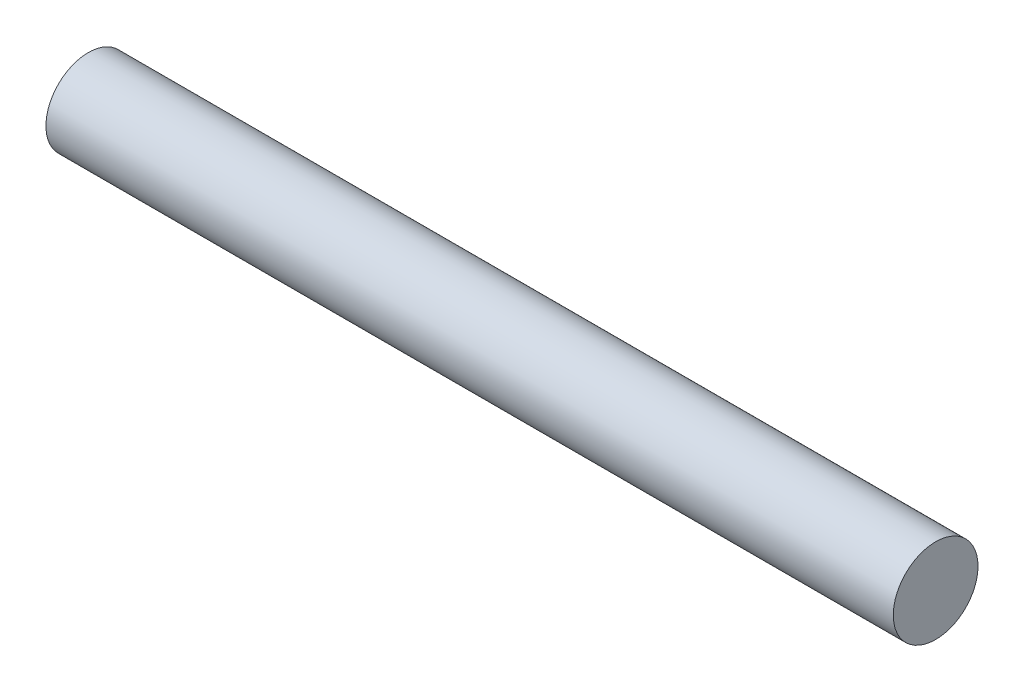
from build123d import *

# Parameters (mm, degrees)
SKETCH2_R           = 5
BOSS_EXTRUDE1_DEPTH = 100


with BuildPart() as part:
    # Sketch2 → Boss-Extrude1 (new body)
    with BuildSketch(Plane(origin=(0, 0, 0), x_dir=(0, 0, -1), z_dir=(1, 0, 0))):
        Circle(SKETCH2_R)
    extrude(amount=BOSS_EXTRUDE1_DEPTH)


solid = part.part
